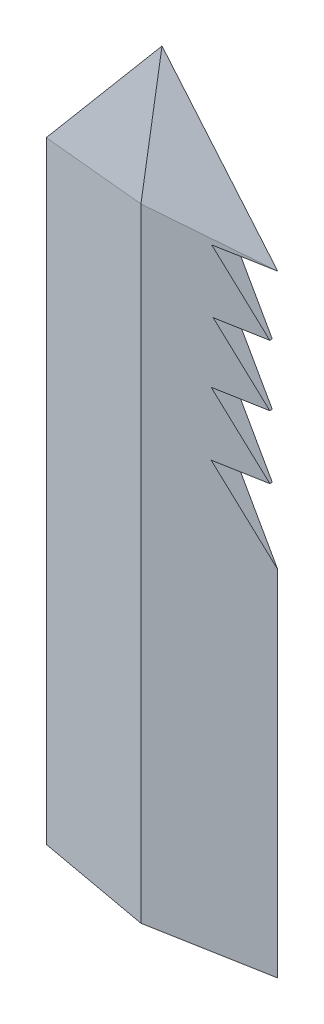
from build123d import *

# Parameters (mm, degrees)
BOSS_EXTRUDE1_DEPTH      = 9.525
BOSS_EXTRUDE1_DEPTH_BACK = 9.525
CUT_EXTRUDE1_DEPTH       = 373.680910299
CUT_EXTRUDE2_DEPTH       = 373.680910299
SKETCH5_W                = 97.518379051
SKETCH5_H                = 136.419580789
CUT_EXTRUDE3_DEPTH       = 739.741184154
SKETCH6_W                = 75.100700845
SKETCH6_H                = 154.277977479
CUT_EXTRUDE4_DEPTH       = 748.678846608
SKETCH7_R                = 4.7625
CUT_EXTRUDE5_DEPTH       = 254


with BuildPart() as part:
    # Sketch1 → Boss-Extrude1 (new, two sides: drawn at the far end of the back side and taken through both)
    with BuildSketch(Plane.XY.offset(-BOSS_EXTRUDE1_DEPTH_BACK)):
        Polygon((101.792411443, 735.656458749), (49.404911443, 673.557276224), (49.404911443, 396.497366015), (154.179911443, 396.497366015), (154.179911443, 556.636391043), (128.683999881, 589.063224066), (151.148766449, 589.063224066), (128.683999881, 617.634912224), (151.148766449, 617.634912224), (129.452026088, 645.229790529), (151.148766449, 645.229790529), (128.876006433, 673.557276224), (154.179911443, 673.557276224), align=None)
    extrude(amount=BOSS_EXTRUDE1_DEPTH + BOSS_EXTRUDE1_DEPTH_BACK)

    # Sketch2 → Cut-Extrude1 (cut, through all)
    with BuildSketch(Plane(origin=(0, 396.497366015, 0), x_dir=(-1, 0, 0), z_dir=(0, -1, 0))):
        Polygon((-49.404911443, 0), (-101.792411443, -9.525), (-154.179911443, 0), (-159.65732669, 0), (-159.65732669, -13.649148588), (-44.158493861, -13.649148588), (-44.158493861, 0), align=None)
    extrude(amount=-CUT_EXTRUDE1_DEPTH, mode=Mode.SUBTRACT)

    # Sketch3 → Cut-Extrude2 (cut, through all)
    with BuildSketch(Plane.XZ.offset(-396.497366015)):
        Polygon((49.404911443, 0), (101.792411443, -9.525), (154.179911443, 0), (159.580570647, 0), (159.580570647, -14.500746269), (43.682013433, -14.500746269), (43.682013433, 0), align=None)
    extrude(amount=-CUT_EXTRUDE2_DEPTH, mode=Mode.SUBTRACT)

    # Sketch5 → Cut-Extrude3 (cut, through all)
    with BuildSketch(Plane(origin=(26.430459561, 22.297003663, 133.782021979), x_dir=(0.9815360247212257, -0.031445805879602766, -0.1886748352776165), z_dir=(0.1912773697394791, 0.16136352846789567, 0.9681811708073739))):
        with Locations((89.248369642, 700.742830845)):
            Rectangle(SKETCH5_W, SKETCH5_H)
    cut_extrude3 = extrude(amount=CUT_EXTRUDE3_DEPTH, mode=Mode.SUBTRACT)

    # Sketch6 → Cut-Extrude4 (cut, through all)
    with BuildSketch(Plane(origin=(-18.981895096, 16.01331916, 96.079914958), x_dir=(0.9815360247212258, 0.03144580587960229, 0.18867483527761636), z_dir=(-0.19127736973947887, 0.1613635284678934, 0.9681811708073744))):
        with Locations((98.873573013, 697.792784398)):
            Rectangle(SKETCH6_W, SKETCH6_H)
    cut_extrude4 = extrude(amount=CUT_EXTRUDE4_DEPTH, mode=Mode.SUBTRACT)

    # Mirror1: Cut-Extrude3, Cut-Extrude4 across plane
    add(cut_extrude3.mirror(Plane.XY), mode=Mode.SUBTRACT)
    add(cut_extrude4.mirror(Plane.XY), mode=Mode.SUBTRACT)

    # Sketch7 → Cut-Extrude5 (cut)
    with BuildSketch(Plane.XZ.offset(-396.497366015)):
        with Locations((101.792411443, 0)):
            Circle(SKETCH7_R)
    extrude(amount=-CUT_EXTRUDE5_DEPTH, mode=Mode.SUBTRACT)


solid = part.part
